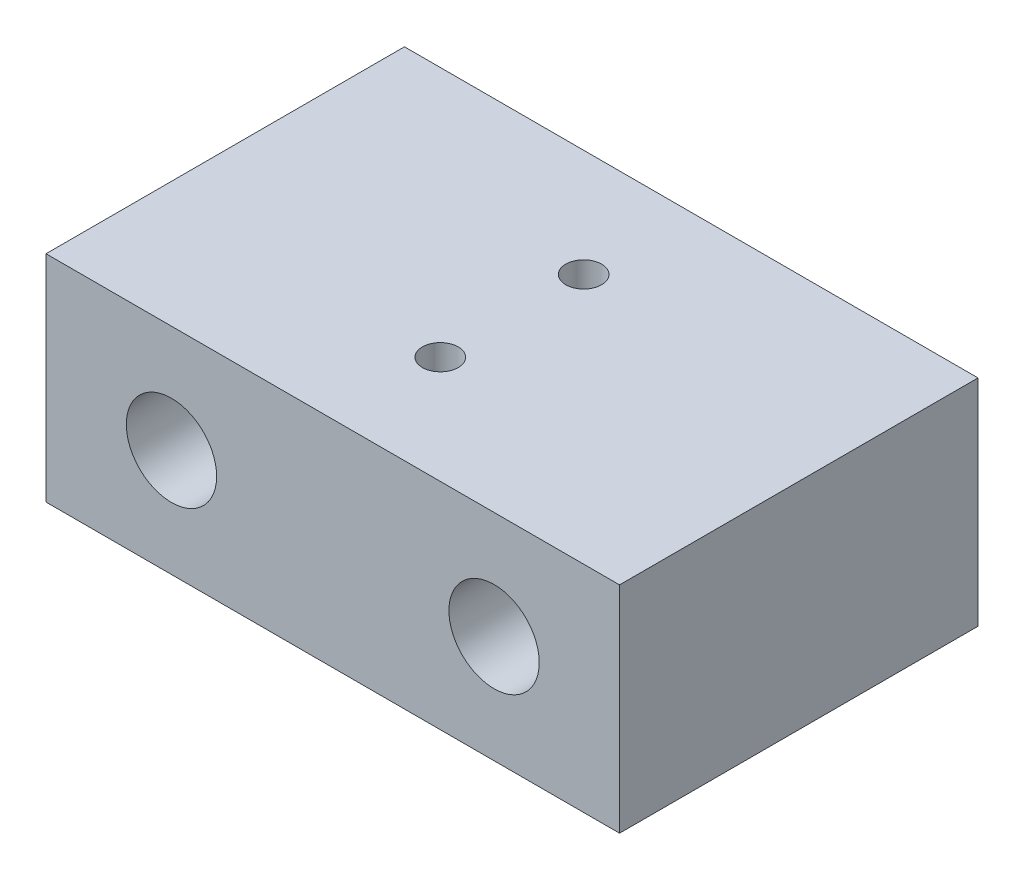
from build123d import *

# Parameters (mm, degrees)
SKETCH1_W           = 50.8
SKETCH1_H           = 19.05
SKETCH1_R           = 4
BOSS_EXTRUDE1_DEPTH = 31.75
SKETCH2_R           = 1.5875
CUT_EXTRUDE1_DEPTH  = 45.901280605


with BuildPart() as part:
    # Sketch1 → Boss-Extrude1 (new body)
    with BuildSketch(Plane.XY):
        Rectangle(SKETCH1_W, SKETCH1_H)
        with Locations((-14.2875, 0)):
            Circle(SKETCH1_R, mode=Mode.SUBTRACT)
        with Locations((14.2875, 0)):
            Circle(SKETCH1_R, mode=Mode.SUBTRACT)
    extrude(amount=BOSS_EXTRUDE1_DEPTH)

    # Sketch2 → Cut-Extrude1 (cut, through all)
    with BuildSketch(Plane(origin=(0, 9.525, 0), x_dir=(1, 0, 0), z_dir=(0, 1, 0))):
        with Locations(Location((0, -9.525, 0), (0, 0, 270))):
            Circle(SKETCH2_R)
        with Locations(Location((0, -22.225, 0), (0, 0, 270))):
            Circle(SKETCH2_R)
    extrude(amount=-CUT_EXTRUDE1_DEPTH, mode=Mode.SUBTRACT)


solid = part.part
